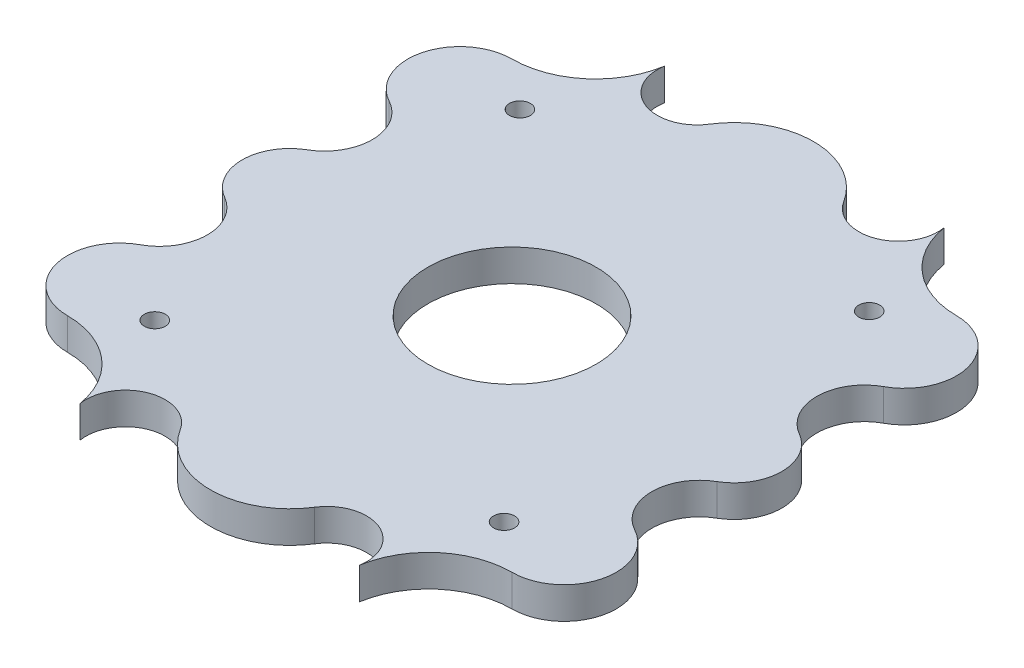
from build123d import *

# Parameters (mm, degrees)
SALIENTE_EXTRUIR1_DEPTH                              = 10
SALIENTE_EXTRUIR2_DEPTH                              = 10
CROQUIS3_R                                           = 26.5
CORTAR_EXTRUIR1_DEPTH                                = 10
REFRENTADO_PARA_TORNILLO_CON_CABEZA_HUEC_D           = 6.6
REFRENTADO_PARA_TORNILLO_CON_CABEZA_HUEC_CBORE_D     = 11
REFRENTADO_PARA_TORNILLO_CON_CABEZA_HUEC_CBORE_DEPTH = 4.4


with BuildPart() as part:
    # Croquis1 → Saliente-Extruir1 (new body)
    with BuildSketch(Plane(origin=(0, 0, 0), x_dir=(1, 0, 0), z_dir=(0, 1, 0))):
        with BuildLine():
            Line((-70, -70), (-70, 70))
            ThreePointArc((-70, 70), (-52.983030462, 76.249658661), (-44.055908755, 92.027554074))
            ThreePointArc((-44.055908755, 92.027554074), (-36.156795126, 78.313355526), (-21.147629234, 83.333333333))
            ThreePointArc((-21.147629234, 83.333333333), (0, 95), (21.147629234, 83.333333333))
            ThreePointArc((21.147629234, 83.333333333), (36.156795126, 78.313355526), (44.055908755, 92.027554074))
            ThreePointArc((44.055908755, 92.027554074), (52.983030462, 76.249658661), (70, 70))
            Line((70, 70), (70, -70))
            ThreePointArc((70, -70), (52.983030462, -76.249658661), (44.055908755, -92.027554074))
            ThreePointArc((44.055908755, -92.027554074), (36.156795126, -78.313355526), (21.147629234, -83.333333333))
            ThreePointArc((21.147629234, -83.333333333), (0, -95), (-21.147629234, -83.333333333))
            ThreePointArc((-21.147629234, -83.333333333), (-36.156795126, -78.313355526), (-44.055908755, -92.027554074))
            ThreePointArc((-44.055908755, -92.027554074), (-52.983030462, -76.249658661), (-70, -70))
        make_face()
    extrude(amount=SALIENTE_EXTRUIR1_DEPTH)

    # Croquis2 → Saliente-Extruir2 (add)
    with BuildSketch(Plane(origin=(0, 10, 0), x_dir=(1, 0, 0), z_dir=(0, 1, 0))):
        with BuildLine():
            Line((-70, 25.98076189), (-70, 70))
            ThreePointArc((-70, 70), (-85.909969357, 57.627811916), (-77.837993487, 39.160506523))
            ThreePointArc((-77.837993487, 39.160506523), (-72.107558403, 33.647896498), (-70, 25.98076189))
        make_face()
        with BuildLine():
            ThreePointArc((77.837993487, 39.160506523), (85.909969357, 57.627811916), (70, 70))
            Line((70, 70), (70, 25.98076213))
            ThreePointArc((70, 25.98076213), (72.107558465, 33.647896602), (77.837993487, 39.160506523))
        make_face()
        with BuildLine():
            ThreePointArc((77.5, 12.990381057), (72.009618939, 18.480762121), (70, 25.98076213))
            Line((70, 25.98076213), (70, -25.98076213))
            ThreePointArc((70, -25.98076213), (72.009618939, -18.480762121), (77.5, -12.990381057))
            ThreePointArc((77.5, -12.990381057), (85, 0), (77.5, 12.990381057))
        make_face()
        with BuildLine():
            Line((-70, -25.980762199), (-70, 25.98076189))
            ThreePointArc((-70, 25.98076189), (-72.009618999, 18.480762017), (-77.5, 12.990381057))
            ThreePointArc((-77.5, 12.990381057), (-85, 0), (-77.5, -12.990381057))
            ThreePointArc((-77.5, -12.990381057), (-72.009618922, -18.480762151), (-70, -25.980762199))
        make_face()
        with BuildLine():
            Line((-70, -70), (-70, -25.980762199))
            ThreePointArc((-70, -25.980762199), (-72.107558482, -33.647896631), (-77.837993487, -39.160506523))
            ThreePointArc((-77.837993487, -39.160506523), (-85.909969357, -57.627811916), (-70, -70))
        make_face()
        with BuildLine():
            ThreePointArc((77.837993487, -39.160506523), (72.107558465, -33.647896602), (70, -25.98076213))
            Line((70, -25.98076213), (70, -70))
            ThreePointArc((70, -70), (85.909969357, -57.627811916), (77.837993487, -39.160506523))
        make_face()
    extrude(amount=-SALIENTE_EXTRUIR2_DEPTH)

    # Croquis3 → Cortar-Extruir1 (cut)
    with BuildSketch(Plane(origin=(0, 10, 0), x_dir=(1, 0, 0), z_dir=(0, 1, 0))):
        with Locations(Location((0, 0, 0), (0, 0, 270))):
            Circle(CROQUIS3_R)
    extrude(amount=-CORTAR_EXTRUIR1_DEPTH, mode=Mode.SUBTRACT)

    # Refrentado para tornillo con cabeza hueca de M61 (through all)
    with Locations(Plane(origin=(-55, 0, 57.5), x_dir=(0, 0, -1), z_dir=(0, -1, 0))):
        with Locations((0, 0), (0, 110), (115, 110), (115, 0), (57.5, 55)):
            CounterBoreHole(REFRENTADO_PARA_TORNILLO_CON_CABEZA_HUEC_D / 2, REFRENTADO_PARA_TORNILLO_CON_CABEZA_HUEC_CBORE_D / 2, REFRENTADO_PARA_TORNILLO_CON_CABEZA_HUEC_CBORE_DEPTH)


solid = part.part
